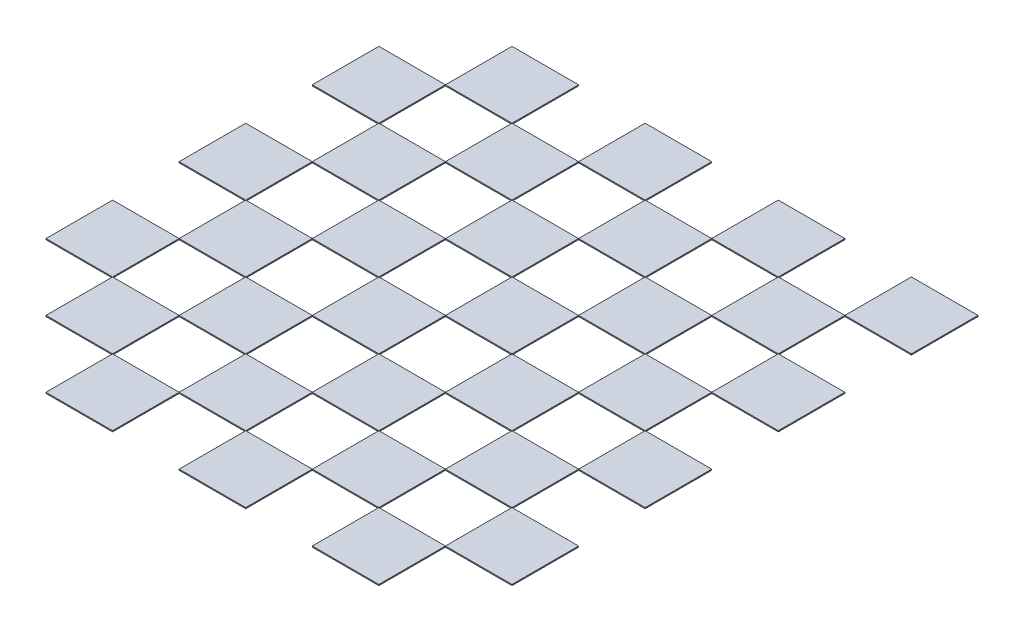
from build123d import *

# Parameters (mm, degrees)
SKETCH1_W              = 25
SKETCH1_H              = 25
BOSS_EXTRUDE1_DEPTH    = 0.4
BOSS_EXTRUDE1_2_DEPTH  = 0.4
BOSS_EXTRUDE1_3_DEPTH  = 0.4
BOSS_EXTRUDE1_4_DEPTH  = 0.4
BOSS_EXTRUDE1_5_DEPTH  = 0.4
BOSS_EXTRUDE1_6_DEPTH  = 0.4
BOSS_EXTRUDE1_7_DEPTH  = 0.4
BOSS_EXTRUDE1_8_DEPTH  = 0.4
BOSS_EXTRUDE1_9_DEPTH  = 0.4
BOSS_EXTRUDE1_10_DEPTH = 0.4
BOSS_EXTRUDE1_11_DEPTH = 0.4
BOSS_EXTRUDE1_12_DEPTH = 0.4
BOSS_EXTRUDE1_13_DEPTH = 0.4
BOSS_EXTRUDE1_14_DEPTH = 0.4
BOSS_EXTRUDE1_15_DEPTH = 0.4
BOSS_EXTRUDE1_16_DEPTH = 0.4
BOSS_EXTRUDE1_17_DEPTH = 0.4
BOSS_EXTRUDE1_18_DEPTH = 0.4
BOSS_EXTRUDE1_19_DEPTH = 0.4
BOSS_EXTRUDE1_20_DEPTH = 0.4
BOSS_EXTRUDE1_21_DEPTH = 0.4
BOSS_EXTRUDE1_22_DEPTH = 0.4
BOSS_EXTRUDE1_23_DEPTH = 0.4
BOSS_EXTRUDE1_24_DEPTH = 0.4
BOSS_EXTRUDE1_25_DEPTH = 0.4
BOSS_EXTRUDE1_26_DEPTH = 0.4
BOSS_EXTRUDE1_27_DEPTH = 0.4
BOSS_EXTRUDE1_28_DEPTH = 0.4
BOSS_EXTRUDE1_29_DEPTH = 0.4
BOSS_EXTRUDE1_30_DEPTH = 0.4
BOSS_EXTRUDE1_31_DEPTH = 0.4


with BuildPart() as part:
    # Sketch1 → Boss-Extrude1 (new body)
    with BuildSketch(Plane(origin=(0, 0, 0), x_dir=(1, 0, 0), z_dir=(0, 1, 0))):
        with Locations((-62.5, -62.5)):
            Rectangle(SKETCH1_W, SKETCH1_H)
    extrude(amount=BOSS_EXTRUDE1_DEPTH)


with BuildPart() as body_2:
    # Sketch1 → Boss-Extrude1 2 (new body)
    with BuildSketch(Plane(origin=(0, 0, 0), x_dir=(1, 0, 0), z_dir=(0, 1, 0))):
        with Locations((-37.5, -87.5)):
            Rectangle(SKETCH1_W, SKETCH1_H)
    extrude(amount=BOSS_EXTRUDE1_2_DEPTH)


with BuildPart() as body_3:
    # Sketch1 → Boss-Extrude1 3 (new body)
    with BuildSketch(Plane(origin=(0, 0, 0), x_dir=(1, 0, 0), z_dir=(0, 1, 0))):
        with Locations((-12.5, -62.5)):
            Rectangle(SKETCH1_W, SKETCH1_H)
    extrude(amount=BOSS_EXTRUDE1_3_DEPTH)


with BuildPart() as body_4:
    # Sketch1 → Boss-Extrude1 4 (new body)
    with BuildSketch(Plane(origin=(0, 0, 0), x_dir=(1, 0, 0), z_dir=(0, 1, 0))):
        with Locations((12.5, -87.5)):
            Rectangle(SKETCH1_W, SKETCH1_H)
    extrude(amount=BOSS_EXTRUDE1_4_DEPTH)


with BuildPart() as body_5:
    # Sketch1 → Boss-Extrude1 5 (new body)
    with BuildSketch(Plane(origin=(0, 0, 0), x_dir=(1, 0, 0), z_dir=(0, 1, 0))):
        with Locations((37.5, -62.5)):
            Rectangle(SKETCH1_W, SKETCH1_H)
    extrude(amount=BOSS_EXTRUDE1_5_DEPTH)


with BuildPart() as body_6:
    # Sketch1 → Boss-Extrude1 6 (new body)
    with BuildSketch(Plane(origin=(0, 0, 0), x_dir=(1, 0, 0), z_dir=(0, 1, 0))):
        with Locations((62.5, -87.5)):
            Rectangle(SKETCH1_W, SKETCH1_H)
    extrude(amount=BOSS_EXTRUDE1_6_DEPTH)


with BuildPart() as body_7:
    # Sketch1 → Boss-Extrude1 7 (new body)
    with BuildSketch(Plane(origin=(0, 0, 0), x_dir=(1, 0, 0), z_dir=(0, 1, 0))):
        with Locations((87.5, -62.5)):
            Rectangle(SKETCH1_W, SKETCH1_H)
    extrude(amount=BOSS_EXTRUDE1_7_DEPTH)


with BuildPart() as body_8:
    # Sketch1 → Boss-Extrude1 8 (new body)
    with BuildSketch(Plane(origin=(0, 0, 0), x_dir=(1, 0, 0), z_dir=(0, 1, 0))):
        with Locations((62.5, -37.5)):
            Rectangle(SKETCH1_W, SKETCH1_H)
    extrude(amount=BOSS_EXTRUDE1_8_DEPTH)


with BuildPart() as body_9:
    # Sketch1 → Boss-Extrude1 9 (new body)
    with BuildSketch(Plane(origin=(0, 0, 0), x_dir=(1, 0, 0), z_dir=(0, 1, 0))):
        with Locations((37.5, -12.5)):
            Rectangle(SKETCH1_W, SKETCH1_H)
    extrude(amount=BOSS_EXTRUDE1_9_DEPTH)


with BuildPart() as body_10:
    # Sketch1 → Boss-Extrude1 10 (new body)
    with BuildSketch(Plane(origin=(0, 0, 0), x_dir=(1, 0, 0), z_dir=(0, 1, 0))):
        with Locations((12.5, -37.5)):
            Rectangle(SKETCH1_W, SKETCH1_H)
    extrude(amount=BOSS_EXTRUDE1_10_DEPTH)


with BuildPart() as body_11:
    # Sketch1 → Boss-Extrude1 11 (new body)
    with BuildSketch(Plane(origin=(0, 0, 0), x_dir=(1, 0, 0), z_dir=(0, 1, 0))):
        with Locations((-37.5, -37.5)):
            Rectangle(SKETCH1_W, SKETCH1_H)
    extrude(amount=BOSS_EXTRUDE1_11_DEPTH)


with BuildPart() as body_12:
    # Sketch1 → Boss-Extrude1 12 (new body)
    with BuildSketch(Plane(origin=(0, 0, 0), x_dir=(1, 0, 0), z_dir=(0, 1, 0))):
        with Locations((-87.5, -37.5)):
            Rectangle(SKETCH1_W, SKETCH1_H)
    extrude(amount=BOSS_EXTRUDE1_12_DEPTH)


with BuildPart() as body_13:
    # Sketch1 → Boss-Extrude1 13 (new body)
    with BuildSketch(Plane(origin=(0, 0, 0), x_dir=(1, 0, 0), z_dir=(0, 1, 0))):
        with Locations((-62.5, -12.5)):
            Rectangle(SKETCH1_W, SKETCH1_H)
    extrude(amount=BOSS_EXTRUDE1_13_DEPTH)


with BuildPart() as body_14:
    # Sketch1 → Boss-Extrude1 14 (new body)
    with BuildSketch(Plane(origin=(0, 0, 0), x_dir=(1, 0, 0), z_dir=(0, 1, 0))):
        with Locations((-87.5, 12.5)):
            Rectangle(SKETCH1_W, SKETCH1_H)
    extrude(amount=BOSS_EXTRUDE1_14_DEPTH)


with BuildPart() as body_15:
    # Sketch1 → Boss-Extrude1 15 (new body)
    with BuildSketch(Plane(origin=(0, 0, 0), x_dir=(1, 0, 0), z_dir=(0, 1, 0))):
        with Locations((-62.5, 37.5)):
            Rectangle(SKETCH1_W, SKETCH1_H)
    extrude(amount=BOSS_EXTRUDE1_15_DEPTH)


with BuildPart() as body_16:
    # Sketch1 → Boss-Extrude1 16 (new body)
    with BuildSketch(Plane(origin=(0, 0, 0), x_dir=(1, 0, 0), z_dir=(0, 1, 0))):
        with Locations((-87.5, 62.5)):
            Rectangle(SKETCH1_W, SKETCH1_H)
    extrude(amount=BOSS_EXTRUDE1_16_DEPTH)


with BuildPart() as body_17:
    # Sketch1 → Boss-Extrude1 17 (new body)
    with BuildSketch(Plane(origin=(0, 0, 0), x_dir=(1, 0, 0), z_dir=(0, 1, 0))):
        with Locations((-62.5, 87.5)):
            Rectangle(SKETCH1_W, SKETCH1_H)
    extrude(amount=BOSS_EXTRUDE1_17_DEPTH)


with BuildPart() as body_18:
    # Sketch1 → Boss-Extrude1 18 (new body)
    with BuildSketch(Plane(origin=(0, 0, 0), x_dir=(1, 0, 0), z_dir=(0, 1, 0))):
        with Locations((-37.5, 62.5)):
            Rectangle(SKETCH1_W, SKETCH1_H)
    extrude(amount=BOSS_EXTRUDE1_18_DEPTH)


with BuildPart() as body_19:
    # Sketch1 → Boss-Extrude1 19 (new body)
    with BuildSketch(Plane(origin=(0, 0, 0), x_dir=(1, 0, 0), z_dir=(0, 1, 0))):
        with Locations((-12.5, 87.5)):
            Rectangle(SKETCH1_W, SKETCH1_H)
    extrude(amount=BOSS_EXTRUDE1_19_DEPTH)


with BuildPart() as body_20:
    # Sketch1 → Boss-Extrude1 20 (new body)
    with BuildSketch(Plane(origin=(0, 0, 0), x_dir=(1, 0, 0), z_dir=(0, 1, 0))):
        with Locations((12.5, 62.5)):
            Rectangle(SKETCH1_W, SKETCH1_H)
    extrude(amount=BOSS_EXTRUDE1_20_DEPTH)


with BuildPart() as body_21:
    # Sketch1 → Boss-Extrude1 21 (new body)
    with BuildSketch(Plane(origin=(0, 0, 0), x_dir=(1, 0, 0), z_dir=(0, 1, 0))):
        with Locations((37.5, 87.5)):
            Rectangle(SKETCH1_W, SKETCH1_H)
    extrude(amount=BOSS_EXTRUDE1_21_DEPTH)


with BuildPart() as body_22:
    # Sketch1 → Boss-Extrude1 22 (new body)
    with BuildSketch(Plane(origin=(0, 0, 0), x_dir=(1, 0, 0), z_dir=(0, 1, 0))):
        with Locations((62.5, 62.5)):
            Rectangle(SKETCH1_W, SKETCH1_H)
    extrude(amount=BOSS_EXTRUDE1_22_DEPTH)


with BuildPart() as body_23:
    # Sketch1 → Boss-Extrude1 23 (new body)
    with BuildSketch(Plane(origin=(0, 0, 0), x_dir=(1, 0, 0), z_dir=(0, 1, 0))):
        with Locations((87.5, 37.5)):
            Rectangle(SKETCH1_W, SKETCH1_H)
    extrude(amount=BOSS_EXTRUDE1_23_DEPTH)


with BuildPart() as body_24:
    # Sketch1 → Boss-Extrude1 24 (new body)
    with BuildSketch(Plane(origin=(0, 0, 0), x_dir=(1, 0, 0), z_dir=(0, 1, 0))):
        with Locations((62.5, 12.5)):
            Rectangle(SKETCH1_W, SKETCH1_H)
    extrude(amount=BOSS_EXTRUDE1_24_DEPTH)


with BuildPart() as body_25:
    # Sketch1 → Boss-Extrude1 25 (new body)
    with BuildSketch(Plane(origin=(0, 0, 0), x_dir=(1, 0, 0), z_dir=(0, 1, 0))):
        with Locations((87.5, -12.5)):
            Rectangle(SKETCH1_W, SKETCH1_H)
    extrude(amount=BOSS_EXTRUDE1_25_DEPTH)


with BuildPart() as body_26:
    # Sketch1 → Boss-Extrude1 26 (new body)
    with BuildSketch(Plane(origin=(0, 0, 0), x_dir=(1, 0, 0), z_dir=(0, 1, 0))):
        with Locations((37.5, 37.5)):
            Rectangle(SKETCH1_W, SKETCH1_H)
    extrude(amount=BOSS_EXTRUDE1_26_DEPTH)


with BuildPart() as body_27:
    # Sketch1 → Boss-Extrude1 27 (new body)
    with BuildSketch(Plane(origin=(0, 0, 0), x_dir=(1, 0, 0), z_dir=(0, 1, 0))):
        with Locations((12.5, 12.5)):
            Rectangle(SKETCH1_W, SKETCH1_H)
    extrude(amount=BOSS_EXTRUDE1_27_DEPTH)


with BuildPart() as body_28:
    # Sketch1 → Boss-Extrude1 28 (new body)
    with BuildSketch(Plane(origin=(0, 0, 0), x_dir=(1, 0, 0), z_dir=(0, 1, 0))):
        with Locations((-12.5, 37.5)):
            Rectangle(SKETCH1_W, SKETCH1_H)
    extrude(amount=BOSS_EXTRUDE1_28_DEPTH)


with BuildPart() as body_29:
    # Sketch1 → Boss-Extrude1 29 (new body)
    with BuildSketch(Plane(origin=(0, 0, 0), x_dir=(1, 0, 0), z_dir=(0, 1, 0))):
        with Locations((-37.5, 12.5)):
            Rectangle(SKETCH1_W, SKETCH1_H)
    extrude(amount=BOSS_EXTRUDE1_29_DEPTH)


with BuildPart() as body_30:
    # Sketch1 → Boss-Extrude1 30 (new body)
    with BuildSketch(Plane(origin=(0, 0, 0), x_dir=(1, 0, 0), z_dir=(0, 1, 0))):
        with Locations((-12.5, -12.5)):
            Rectangle(SKETCH1_W, SKETCH1_H)
    extrude(amount=BOSS_EXTRUDE1_30_DEPTH)


with BuildPart() as body_31:
    # Sketch1 → Boss-Extrude1 31 (new body)
    with BuildSketch(Plane(origin=(0, 0, 0), x_dir=(1, 0, 0), z_dir=(0, 1, 0))):
        with Locations((87.5, 87.5)):
            Rectangle(SKETCH1_W, SKETCH1_H)
    extrude(amount=BOSS_EXTRUDE1_31_DEPTH)


solid = Compound([part.part, body_2.part, body_3.part, body_4.part, body_5.part, body_6.part, body_7.part, body_8.part, body_9.part, body_10.part, body_11.part, body_12.part, body_13.part, body_14.part, body_15.part, body_16.part, body_17.part, body_18.part, body_19.part, body_20.part, body_21.part, body_22.part, body_23.part, body_24.part, body_25.part, body_26.part, body_27.part, body_28.part, body_29.part, body_30.part, body_31.part])
